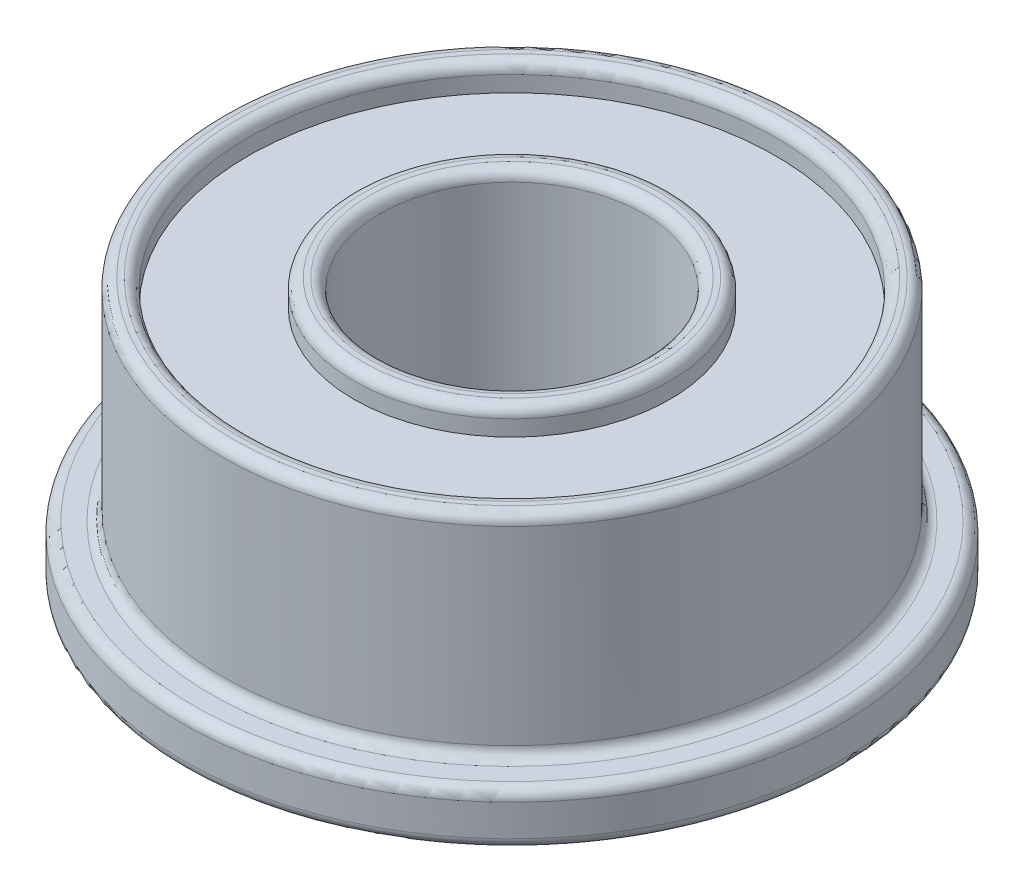
from build123d import *

# Parameters (mm, degrees)
SKETCH_1_R          = 5.5
SKETCH_1_R_2        = 2.5
EXTRUDE_1_DEPTH     = 2.5
EXTRUDE_START       = -1
SKETCH_2_R          = 6.25
SKETCH_2_R_2        = 5.5
EXTRUDE_1_2_DEPTH   = 1
SKETCH_3_R          = 5
SKETCH_3_R_2        = 3
CUT_EXTRUDE_1_DEPTH = 0.5
FILLET_1_R          = 0.2
FILLET_2_R          = 0.2


with BuildPart() as part:
    # ｽｹｯﾁ1 → Extrude 1 (new, symmetric)
    with BuildSketch(Plane(origin=(0, 0, 0), x_dir=(1, 0, 0), z_dir=(0, 1, 0))):
        with Locations(Location((0, 0, 0), (0, 0, 270))):
            Circle(SKETCH_1_R)
        with Locations(Location((0, 0, 0), (0, 0, 270))):
            Circle(SKETCH_1_R_2, mode=Mode.SUBTRACT)
    extrude(amount=EXTRUDE_1_DEPTH, both=True)

    # ｽｹｯﾁ2 → Extrude 1 2 (add)
    with BuildSketch(Plane.XZ.offset(2.5).offset(EXTRUDE_START)):
        Circle(SKETCH_2_R)
        Circle(SKETCH_2_R_2, mode=Mode.SUBTRACT)
    extrude(amount=EXTRUDE_1_2_DEPTH)

    # ｽｹｯﾁ3 → ｶｯﾄ - 押し出し1 (cut, symmetric)
    with BuildSketch(Plane(origin=(0, 2.5, 0), x_dir=(1, 0, 0), z_dir=(0, 1, 0))):
        with Locations(Location((0, 0, 0), (0, 0, 270))):
            Circle(SKETCH_3_R)
        with Locations(Location((0, 0, 0), (0, 0, 270))):
            Circle(SKETCH_3_R_2, mode=Mode.SUBTRACT)
    cut_extrude_1 = extrude(amount=CUT_EXTRUDE_1_DEPTH, both=True, mode=Mode.SUBTRACT)

    # ﾐﾗｰ1: ｶｯﾄ - 押し出し1 across plane
    add(cut_extrude_1.mirror(Plane.ZX), mode=Mode.SUBTRACT)

    # ﾌｨﾚｯﾄ1
    fillet_1_edges = [part.edges().sort_by_distance(p)[0] for p in [
        (-6.25, -2.5, 0),
        (0, 2.5, -5),
        (0, 2.5, -3),
        (0, -2.5, -3),
        (0, -2.5, -5),
        (0, 2.5, -5.5),
        (0, -2.5, -2.5),
        (0, 2.5, -2.5),
        (0, -1.5, -5.5),
    ]]
    fillet(fillet_1_edges, radius=FILLET_1_R)

    # ﾌｨﾚｯﾄ2
    fillet_2_edges = [part.edges().sort_by_distance(p)[0] for p in [
        (-6.25, -1.5, 0),
    ]]
    fillet(fillet_2_edges, radius=FILLET_2_R)


solid = part.part
